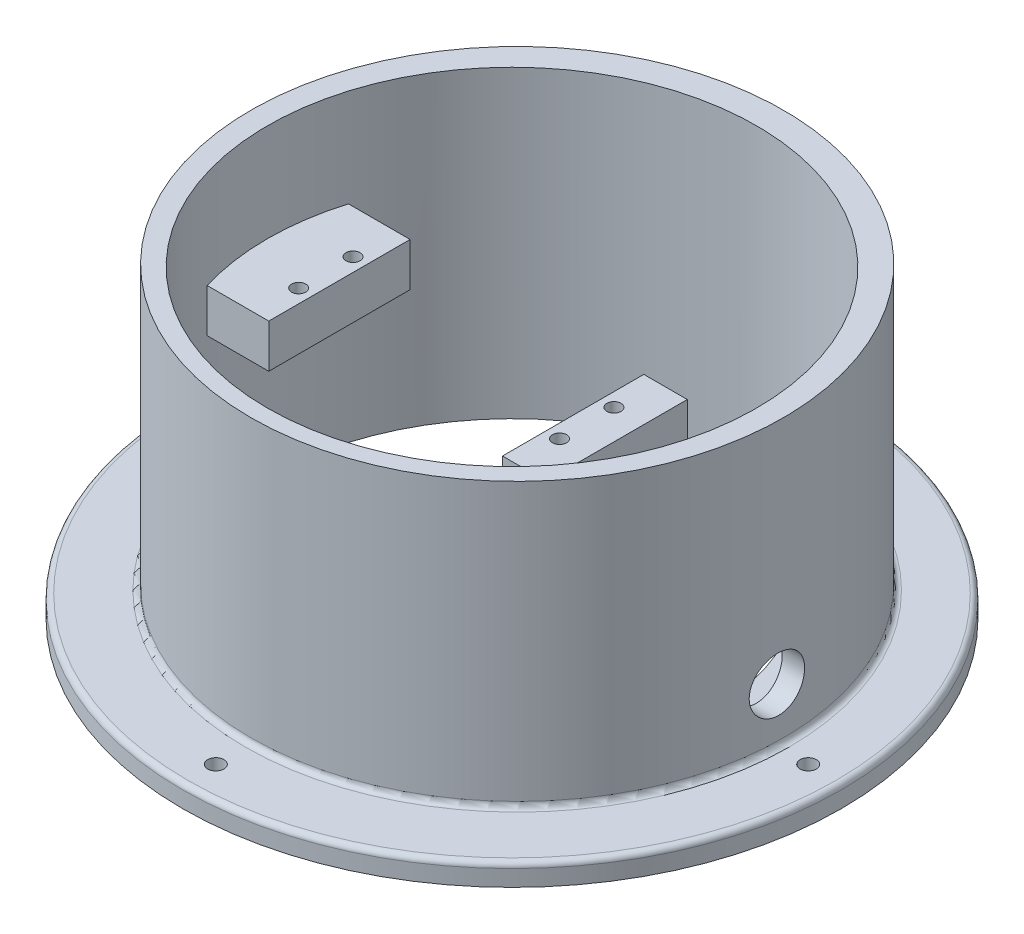
from build123d import *

# Parameters (mm, degrees)
SKETCH2_R           = 60.625
SKETCH2_R_2         = 45
BOSS_EXTRUDE1_DEPTH = 4
SKETCH4_R           = 49
SKETCH4_R_2         = 45
BOSS_EXTRUDE2_DEPTH = 52
SKETCH5_W           = 8
SKETCH5_H           = 38
SKETCH5_W_2         = 15
SKETCH5_H_2         = 8
BOSS_EXTRUDE3_DEPTH = 13
SKETCH6_W           = 10
SKETCH6_H           = 24
CUT_EXTRUDE2_DEPTH  = 8
SKETCH7_R           = 5
CUT_EXTRUDE3_DEPTH  = 110.441337026
SKETCH8_R           = 1.3
CUT_EXTRUDE4_DEPTH  = 7.2
BOSS_EXTRUDE4_DEPTH = 4
SKETCH10_R          = 1.5
CUT_EXTRUDE5_DEPTH  = 103.404986506
FILLET1_R           = 1


with BuildPart() as part:
    # Sketch2 → Boss-Extrude1 (new body)
    with BuildSketch(Plane(origin=(0, 0, 0), x_dir=(1, 0, 0), z_dir=(0, 1, 0))):
        with Locations(Location((0, 0, 0), (0, 0, 270))):
            Circle(SKETCH2_R)
        with Locations(Location((0, 0, 0), (0, 0, 270))):
            Circle(SKETCH2_R_2, mode=Mode.SUBTRACT)
    extrude(amount=BOSS_EXTRUDE1_DEPTH)

    # Sketch4 → Boss-Extrude2 (add)
    with BuildSketch(Plane(origin=(0, 4, 0), x_dir=(1, 0, 0), z_dir=(0, 1, 0))):
        with Locations(Location((0, 0.954313472, 0), (0, 0, 90))):
            Circle(SKETCH4_R)
        with Locations(Location((0, 0, 0), (0, 0, 270))):
            Circle(SKETCH4_R_2, mode=Mode.SUBTRACT)
    extrude(amount=BOSS_EXTRUDE2_DEPTH)

    # Sketch5 → Boss-Extrude3 (add, symmetric)
    with BuildSketch(Plane.XY):
        with Locations((15.25, 19)):
            Rectangle(SKETCH5_W, SKETCH5_H)
        with Locations((-39.25, 34)):
            Rectangle(SKETCH5_W_2, SKETCH5_H_2)
    extrude(amount=BOSS_EXTRUDE3_DEPTH, both=True)


with BuildPart() as boss_extrude3_piece_1:
    # of the separate pieces the step leaves, piece 1, a body of its own (boss_extrude3_pieces)
    add(part.part.solids().sort_by_distance((0, 0, 60.625))[0])

    # Sketch7 → Cut-Extrude3 (cut, through all)
    with BuildSketch(Plane.ZY.offset(-11.25)):
        with Locations((0, 14)):
            Circle(SKETCH7_R)
    extrude(amount=-CUT_EXTRUDE3_DEPTH, mode=Mode.SUBTRACT)


with BuildPart() as boss_extrude3_piece_2:
    # of the separate pieces the step leaves, piece 2, a body of its own (boss_extrude3_pieces)
    add(part.part.solids().sort_by_distance((11.25, 0, -13))[0])

    # Sketch6 → Cut-Extrude2 (cut)
    with BuildSketch(Plane.ZY.offset(-11.25)):
        with Locations((0, 17)):
            Rectangle(SKETCH6_W, SKETCH6_H)
    extrude(amount=-CUT_EXTRUDE2_DEPTH, mode=Mode.SUBTRACT)


with BuildPart() as cut_extrude4_tool:
    # Sketch8 → Cut-Extrude4 (new body)
    with BuildSketch(Plane(origin=(0, 38, 0), x_dir=(1, 0, 0), z_dir=(0, 1, 0))):
        with Locations(Location((-34.25, 5, 0), (0, 0, 270))):
            Circle(SKETCH8_R)
        with Locations(Location((-34.25, -5, 0), (0, 0, 270))):
            Circle(SKETCH8_R)
        with Locations(Location((13.75, -5, 0), (0, 0, 270))):
            Circle(SKETCH8_R)
        with Locations(Location((13.75, 5, 0), (0, 0, 270))):
            Circle(SKETCH8_R)
    extrude(amount=-CUT_EXTRUDE4_DEPTH)


with BuildPart() as boss_extrude3_piece_1_1:
    add(boss_extrude3_piece_1.part)

    # Cut-Extrude4: cut by cut_extrude4_tool
    add(cut_extrude4_tool.part, mode=Mode.SUBTRACT)



with BuildPart() as boss_extrude3_piece_2_1:
    add(boss_extrude3_piece_2.part)

    # Cut-Extrude4: cut by cut_extrude4_tool
    add(cut_extrude4_tool.part, mode=Mode.SUBTRACT)


with BuildPart() as boss_extrude3_piece_1_2:
    add(boss_extrude3_piece_1_1.part)

    add(boss_extrude3_piece_2_1.part)  # Boss-Extrude4 merges Boss-Extrude3 piece 2
    # Sketch9 → Boss-Extrude4 (add)
    with BuildSketch(Plane.XZ):
        with BuildLine():
            Line((11.25, 13), (25.249838503, 37.248431585))
            ThreePointArc((25.249838503, 37.248431585), (45, 0), (25.249838503, -37.248431585))
            Line((25.249838503, -37.248431585), (11.25, -13))
            Line((11.25, -13), (11.25, 13))
        make_face()
        with BuildLine():
            Line((24.25, 19.516660498), (27.361802413, 24.906460381))
            ThreePointArc((27.361802413, 24.906460381), (37, 0), (27.361802413, -24.906460381))
            Line((27.361802413, -24.906460381), (24.25, -19.516660498))
            Line((24.25, -19.516660498), (24.25, 19.516660498))
        make_face(mode=Mode.SUBTRACT)
    extrude(amount=-BOSS_EXTRUDE4_DEPTH)

    # Sketch10 → Cut-Extrude5 (cut, through all)
    with BuildSketch(Plane.XZ):
        with Locations(Location((54.5, 0, 0), (0, 0, 270))):
            Circle(SKETCH10_R)
        with Locations(Location((0, -54.5, 0), (0, 0, 270))):
            Circle(SKETCH10_R)
        with Locations(Location((-54.5, 0, 0), (0, 0, 270))):
            Circle(SKETCH10_R)
        with Locations(Location((0, 54.5, 0), (0, 0, 270))):
            Circle(SKETCH10_R)
    extrude(amount=-CUT_EXTRUDE5_DEPTH, mode=Mode.SUBTRACT)

    # Fillet1
    fillet1_edges = [boss_extrude3_piece_1_2.edges().sort_by_distance(p)[0] for p in [
        (0, 4, -60.625),
        (0, 4, 48.045686528),
    ]]
    fillet(fillet1_edges, radius=FILLET1_R)


solid = boss_extrude3_piece_1_2.part
